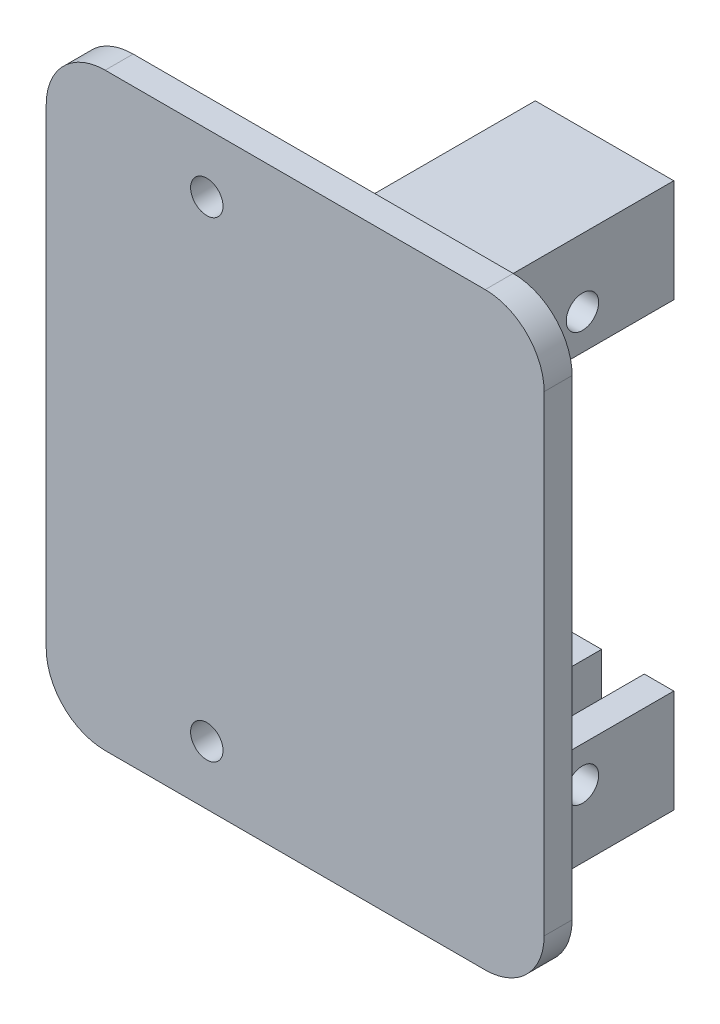
from build123d import *

# Parameters (mm, degrees)
DODANIE_WYCI_GNI_CIE1_DEPTH = 1.9
DODANIE_WYCI_GNI_CIE3_DEPTH = 12.4
ESQUISSE4_R                 = 2.2
BOSS_EXTRU_2_DEPTH          = 2
ESQUISSE5_R                 = 1.1
ENL_V_MAT_EXTRU_2_DEPTH     = 29.971882921
ENL_V_MAT_EXTRU_4_REACH     = 38.806
ESQUISSE6_R                 = 1.1
ENL_V_START                 = -2.2
ESQUISSE7_R                 = 1.6
ESQUISSE7_R_2               = 1.1
ENL_V_MAT_EXTRU_5_DEPTH     = 2.2


with BuildPart() as part:
    # Szkic1 → Dodanie-wyciągnięcie1 (new body)
    with BuildSketch(Plane.XY):
        with BuildLine():
            Line((-12.9, 20), (12.9, 20))
            ThreePointArc((12.9, 20), (15.728427125, 18.828427125), (16.9, 16))
            Line((16.9, 16), (16.9, -16))
            ThreePointArc((16.9, -16), (15.728427125, -18.828427125), (12.9, -20))
            Line((12.9, -20), (-12.9, -20))
            ThreePointArc((-12.9, -20), (-15.728427125, -18.828427125), (-16.9, -16))
            Line((-16.9, -16), (-16.9, 16))
            ThreePointArc((-16.9, 16), (-15.728427125, 18.828427125), (-12.9, 20))
        make_face()
    extrude(amount=DODANIE_WYCI_GNI_CIE1_DEPTH)

    # Szkic3 → Dodanie-wyciągnięcie3 (add)
    with BuildSketch(Plane(origin=(0, 0, 0), x_dir=(-1, 0, 0), z_dir=(0, 0, -1))):
        Polygon((-9.4, -16.5), (-9.4, -11.5), (-11.4, -11.5), (-11.4, -18.5), (-2, -18.5), (-2, -11.5), (-6.5, -11.5), (-6.5, -16.5), align=None)
        Polygon((-9.4, 11.5), (-11.4, 11.5), (-11.4, 18.5), (-2, 18.5), (-2, 11.5), (-6.5, 11.5), (-6.5, 16.5), (-9.4, 16.5), align=None)
    extrude(amount=DODANIE_WYCI_GNI_CIE3_DEPTH)

    # Esquisse4 → Boss.-Extru.2 (add)
    with BuildSketch(Plane.ZY.offset(16.9)):
        with BuildLine():
            Line((-3.579120726, 8.391358342), (0, 5.442162864))
            Line((0, 5.442162864), (0, -5.442162864))
            Line((0, -5.442162864), (-8.920879274, 1.908641658))
            ThreePointArc((-8.920879274, 1.908641658), (-9.491358342, 7.820879274), (-3.579120726, 8.391358342))
        make_face()
        with Locations(Location((-6.25, 5.15, 0), (0, 0, 270))):
            Circle(ESQUISSE4_R, mode=Mode.SUBTRACT)
    extrude(amount=-BOSS_EXTRU_2_DEPTH)

    # Esquisse5 → Enlèv. mat.-Extru.2 (cut, through all)
    with BuildSketch(Plane(origin=(0, 0, 0), x_dir=(-1, 0, 0), z_dir=(0, 0, -1))):
        with Locations((6, 16)):
            Circle(ESQUISSE5_R)
        with Locations((6, -16)):
            Circle(ESQUISSE5_R)
    extrude(amount=-ENL_V_MAT_EXTRU_2_DEPTH, mode=Mode.SUBTRACT)

    # Enlèv. mat.-Extru.4: up to this face of the body (flat: up to its plane)
    enl_v_mat_extru_4_end = Plane(part.part.faces().sort_by_distance((2, 15, -6.2))[0])
    # Esquisse6 → Enlèv. mat.-Extru.4 (cut, up to the picked face)
    with BuildSketch(Plane(origin=(11.4, 0, 0), x_dir=(0, 0, -1), z_dir=(1, 0, 0)), mode=Mode.PRIVATE) as enl_v_mat_extru_4_sk1:
        with Locations((6.2, 13.9)):
            Circle(ESQUISSE6_R)
    enl_v_mat_extru_4_tool1 = split(extrude(enl_v_mat_extru_4_sk1.sketch, amount=-ENL_V_MAT_EXTRU_4_REACH, mode=Mode.PRIVATE), bisect_by=enl_v_mat_extru_4_end, keep=Keep.BOTH, mode=Mode.PRIVATE)
    # Esquisse6 → Enlèv. mat.-Extru.4 (cut, up to the picked face)
    with BuildSketch(Plane(origin=(11.4, 0, 0), x_dir=(0, 0, -1), z_dir=(1, 0, 0)), mode=Mode.PRIVATE) as enl_v_mat_extru_4_sk2:
        with Locations((6.2, -13.9)):
            Circle(ESQUISSE6_R)
    enl_v_mat_extru_4_tool2 = split(extrude(enl_v_mat_extru_4_sk2.sketch, amount=-ENL_V_MAT_EXTRU_4_REACH, mode=Mode.PRIVATE), bisect_by=enl_v_mat_extru_4_end, keep=Keep.BOTH, mode=Mode.PRIVATE)
    add(enl_v_mat_extru_4_tool1.solids().sort_by(Axis((11.4, 13.9, -6.2), (-1, 0, 0)))[0], mode=Mode.SUBTRACT)
    add(enl_v_mat_extru_4_tool2.solids().sort_by(Axis((11.4, -13.9, -6.2), (-1, 0, 0)))[0], mode=Mode.SUBTRACT)

    # Esquisse7 → Enlèv. mat.-Extru.5 (cut)
    # profile 1 of 4: a face of its own
    with BuildSketch(Plane.ZY.offset(-2).offset(ENL_V_START)):
        with Locations(Location((-6.2, 13.9, 0), (0, 0, 270))):
            Circle(ESQUISSE7_R)
        with Locations(Location((-6.2, 13.9, 0), (0, 0, 180))):
            Circle(ESQUISSE7_R_2, mode=Mode.SUBTRACT)
    # profile 2 of 4: a face of its own
    with BuildSketch(Plane.ZY.offset(-2).offset(ENL_V_START)):
        with Locations(Location((-6.2, 13.9, 0), (0, 0, 180))):
            Circle(ESQUISSE7_R_2)
    # profile 3 of 4: a face of its own
    with BuildSketch(Plane.ZY.offset(-2).offset(ENL_V_START)):
        with Locations(Location((-6.2, -13.9, 0), (0, 0, 270))):
            Circle(ESQUISSE7_R)
        with Locations(Location((-6.2, -13.9, 0), (0, 0, 270))):
            Circle(ESQUISSE7_R_2, mode=Mode.SUBTRACT)
    # profile 4 of 4: a face of its own
    with BuildSketch(Plane.ZY.offset(-2).offset(ENL_V_START)):
        with Locations(Location((-6.2, -13.9, 0), (0, 0, 270))):
            Circle(ESQUISSE7_R_2)
    extrude(amount=ENL_V_MAT_EXTRU_5_DEPTH, mode=Mode.SUBTRACT)


solid = part.part
